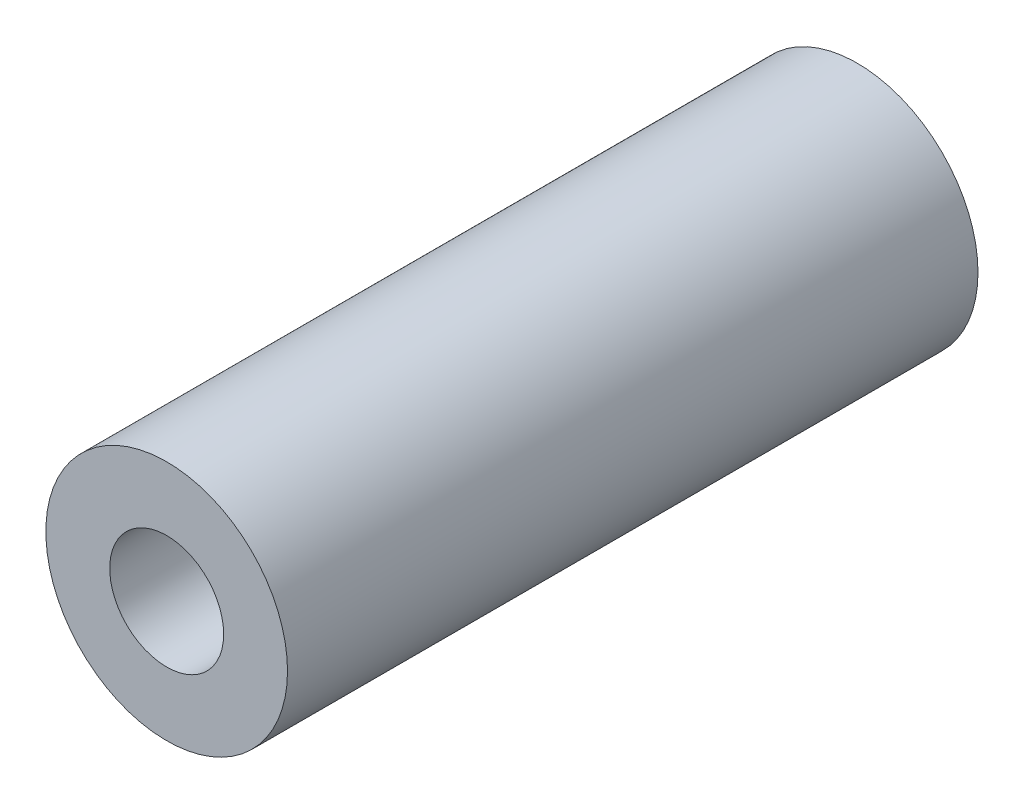
from build123d import *

# Parameters (mm, degrees)
SKETCH_1_R         = 3.5
EXTRUDE_1_DEPTH    = 20
HOLE_WIZARD_M4_1_D = 3.3


with BuildPart() as part:
    # 草图1 → 凸台-拉伸1 (new body)
    with BuildSketch(Plane.XY):
        Circle(SKETCH_1_R)
    extrude(amount=EXTRUDE_1_DEPTH)

    # M4 螺纹孔1 (through all)
    with Locations(Plane.XY.offset(20)):
        with Locations((0, 0)):
            Hole(HOLE_WIZARD_M4_1_D / 2)


solid = part.part
